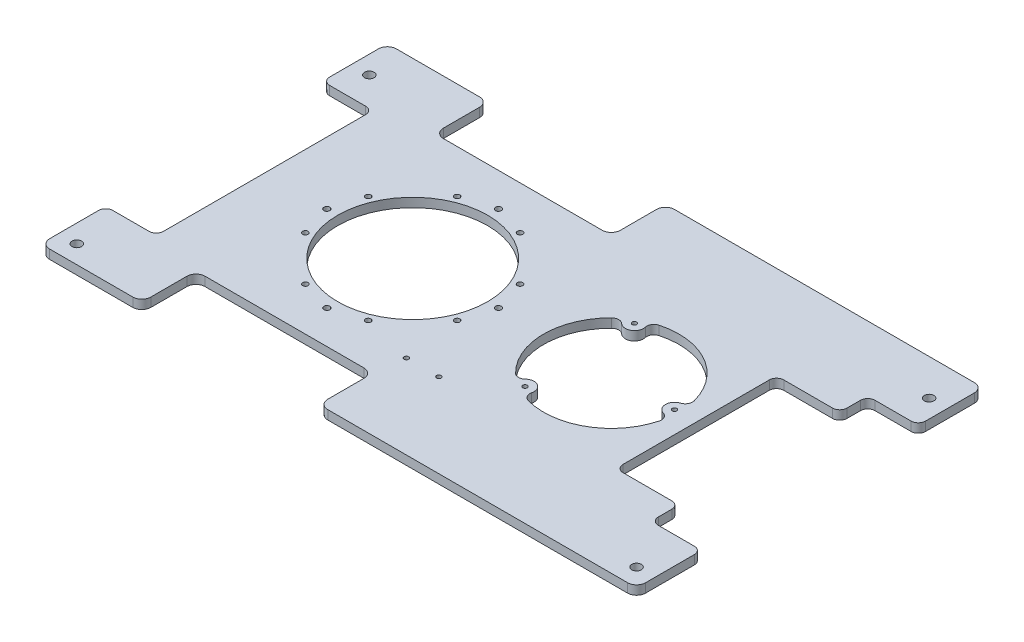
from build123d import *

# Parameters (mm, degrees)
SKETCH1_R           = 1.5
SKETCH1_R_2         = 41.5
SKETCH1_R_3         = 2.65
SKETCH1_R_4         = 1.65
SKETCH1_R_5         = 1.25
BOSS_EXTRUDE1_DEPTH = 5


with BuildPart() as part:
    # Sketch1 → Boss-Extrude1 (new body)
    with BuildSketch(Plane.XZ):
        with BuildLine():
            Line((159, -192), (325, -192))
            ThreePointArc((325, -192), (328.535533906, -190.535533906), (330, -187))
            Line((330, -187), (330, -160))
            ThreePointArc((330, -160), (328.828427125, -157.171572875), (326, -156))
            Line((326, -156), (306, -156))
            ThreePointArc((306, -156), (303.171572875, -154.828427125), (302, -152))
            Line((302, -152), (302, -144.5))
            ThreePointArc((302, -144.5), (300.828427125, -141.671572875), (298, -140.5))
            Line((298, -140.5), (271, -140.5))
            ThreePointArc((271, -140.5), (268.171572875, -139.328427125), (267, -136.5))
            Line((267, -136.5), (267, -55.5))
            ThreePointArc((267, -55.5), (268.171572875, -52.671572875), (271, -51.5))
            Line((271, -51.5), (298, -51.5))
            ThreePointArc((298, -51.5), (300.828427125, -50.328427125), (302, -47.5))
            Line((302, -47.5), (302, -40))
            ThreePointArc((302, -40), (303.171572875, -37.171572875), (306, -36))
            Line((306, -36), (326, -36))
            ThreePointArc((326, -36), (328.828427125, -34.828427125), (330, -32))
            Line((330, -32), (330, -5))
            ThreePointArc((330, -5), (328.535533906, -1.464466094), (325, 0))
            Line((325, 0), (159, 0))
            ThreePointArc((159, 0), (155.464466094, -1.464466094), (154, -5))
            Line((154, -5), (154, -25))
            ThreePointArc((154, -25), (152.535533906, -28.535533906), (149, -30))
            Line((149, -30), (61, -30))
            ThreePointArc((61, -30), (57.464466094, -28.535533906), (56, -25))
            Line((56, -25), (56, -5))
            ThreePointArc((56, -5), (54.535533906, -1.464466094), (51, 0))
            Line((51, 0), (5, 0))
            ThreePointArc((5, 0), (1.464466094, -1.464466094), (0, -5))
            Line((0, -5), (0, -32))
            ThreePointArc((0, -32), (1.171572875, -34.828427125), (4, -36))
            Line((4, -36), (24, -36))
            ThreePointArc((24, -36), (26.828427125, -37.171572875), (28, -40))
            Line((28, -40), (28, -152))
            ThreePointArc((28, -152), (26.828427125, -154.828427125), (24, -156))
            Line((24, -156), (4, -156))
            ThreePointArc((4, -156), (1.171572875, -157.171572875), (0, -160))
            Line((0, -160), (0, -187))
            ThreePointArc((0, -187), (1.464466094, -190.535533906), (5, -192))
            Line((5, -192), (51, -192))
            ThreePointArc((51, -192), (54.535533906, -190.535533906), (56, -187))
            Line((56, -187), (56, -167))
            ThreePointArc((56, -167), (57.464466094, -163.464466094), (61, -162))
            Line((61, -162), (149, -162))
            ThreePointArc((149, -162), (152.535533906, -163.464466094), (154, -167))
            Line((154, -167), (154, -187))
            ThreePointArc((154, -187), (155.464466094, -190.535533906), (159, -192))
        make_face()
        with Locations(Location((92.587903827, -138.036518729, 0), (0, 0, 90))):
            Circle(SKETCH1_R, mode=Mode.SUBTRACT)
        with Locations(Location((127.412096173, -138.036518729, 0), (0, 0, 90))):
            Circle(SKETCH1_R, mode=Mode.SUBTRACT)
        with Locations(Location((152.036518729, -113.412096173, 0), (0, 0, 90))):
            Circle(SKETCH1_R, mode=Mode.SUBTRACT)
        with Locations(Location((152.036518729, -78.587903827, 0), (0, 0, 90))):
            Circle(SKETCH1_R, mode=Mode.SUBTRACT)
        with Locations(Location((127.412096173, -53.963481271, 0), (0, 0, 90))):
            Circle(SKETCH1_R, mode=Mode.SUBTRACT)
        with Locations(Location((92.587903827, -53.963481271, 0), (0, 0, 90))):
            Circle(SKETCH1_R, mode=Mode.SUBTRACT)
        with Locations(Location((67.963481271, -78.587903827, 0), (0, 0, 90))):
            Circle(SKETCH1_R, mode=Mode.SUBTRACT)
        with Locations(Location((67.963481271, -113.412096173, 0), (0, 0, 90))):
            Circle(SKETCH1_R, mode=Mode.SUBTRACT)
        with Locations(Location((110, -96, 0), (0, 0, 90))):
            Circle(SKETCH1_R_2, mode=Mode.SUBTRACT)
        with Locations(Location((320, -172, 0), (0, 0, 90))):
            Circle(SKETCH1_R_3, mode=Mode.SUBTRACT)
        with Locations(Location((320, -10, 0), (0, 0, 90))):
            Circle(SKETCH1_R_3, mode=Mode.SUBTRACT)
        with Locations(Location((10, -10, 0), (0, 0, 90))):
            Circle(SKETCH1_R_3, mode=Mode.SUBTRACT)
        with Locations(Location((10, -172, 0), (0, 0, 90))):
            Circle(SKETCH1_R_3, mode=Mode.SUBTRACT)
        with Locations(Location((110, -143.5, 0), (0, 0, 90))):
            Circle(SKETCH1_R_4, mode=Mode.SUBTRACT)
        with Locations(Location((62.5, -96, 0), (0, 0, 90))):
            Circle(SKETCH1_R_4, mode=Mode.SUBTRACT)
        with Locations(Location((110, -48.5, 0), (0, 0, 90))):
            Circle(SKETCH1_R_4, mode=Mode.SUBTRACT)
        with Locations(Location((157.5, -96, 0), (0, 0, 90))):
            Circle(SKETCH1_R_4, mode=Mode.SUBTRACT)
        with Locations(Location((202.5, -126.310889132, 0), (0, 0, 90))):
            Circle(SKETCH1_R_5, mode=Mode.SUBTRACT)
        with Locations(Location((255, -96, 0), (0, 0, 90))):
            Circle(SKETCH1_R_5, mode=Mode.SUBTRACT)
        with Locations(Location((202.5, -65.689110868, 0), (0, 0, 90))):
            Circle(SKETCH1_R_5, mode=Mode.SUBTRACT)
        with Locations(Location((156, -46.5, 0), (0, 0, 90))):
            Circle(SKETCH1_R_5, mode=Mode.SUBTRACT)
        with Locations(Location((174, -46.5, 0), (0, 0, 90))):
            Circle(SKETCH1_R_5, mode=Mode.SUBTRACT)
        with BuildLine():
            ThreePointArc((210.22518928, -59.796366544), (238.75, -63.524047358), (256.240671642, -86.363417673))
            ThreePointArc((256.240671642, -86.363417673), (255.870910902, -89.335183714), (253.541666667, -91.217399882))
            ThreePointArc((253.541666667, -91.217399882), (250, -96), (253.541666667, -100.782600118))
            ThreePointArc((253.541666667, -100.782600118), (255.870910902, -102.664816286), (256.240671642, -105.636582327))
            ThreePointArc((256.240671642, -105.636582327), (238.75, -128.475952642), (210.22518928, -132.203633456))
            ThreePointArc((210.22518928, -132.203633456), (207.836444764, -130.397528241), (207.371019865, -127.439235478))
            ThreePointArc((207.371019865, -127.439235478), (205, -121.980762114), (199.087313468, -122.65663536))
            ThreePointArc((199.087313468, -122.65663536), (196.292644334, -123.732711955), (193.534139078, -122.567051128))
            ThreePointArc((193.534139078, -122.567051128), (182.5, -96), (193.534139078, -69.432948872))
            ThreePointArc((193.534139078, -69.432948872), (196.292644334, -68.267288045), (199.087313468, -69.34336464))
            ThreePointArc((199.087313468, -69.34336464), (205, -70.019237886), (207.371019865, -64.560764522))
            ThreePointArc((207.371019865, -64.560764522), (207.836444764, -61.602471759), (210.22518928, -59.796366544))
        make_face(mode=Mode.SUBTRACT)
    extrude(amount=-BOSS_EXTRUDE1_DEPTH)


solid = part.part
